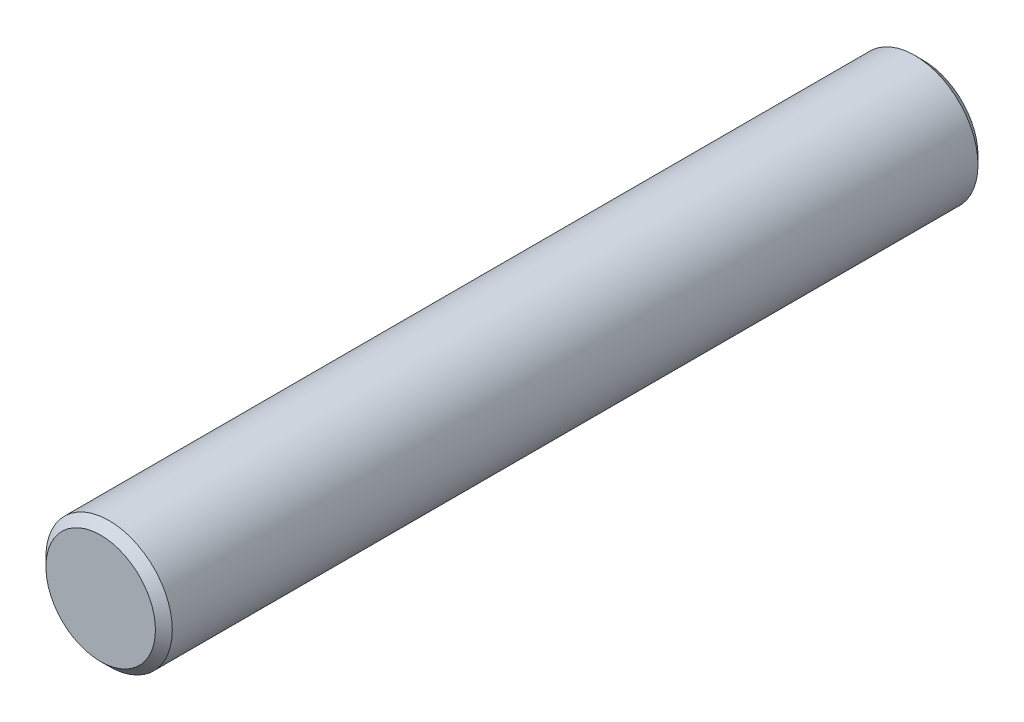
from build123d import *

# Parameters (mm, degrees)
SKETCH1_R      = 3.81
EXTRUDE1_DEPTH = 49.58806723
CHAMFER1_SIZE  = 0.508


with BuildPart() as part:
    # Sketch1 → Extrude1 (new body)
    with BuildSketch(Plane.XY):
        with Locations((0, 114.260861664)):
            Circle(SKETCH1_R)
    extrude(amount=-EXTRUDE1_DEPTH)

    # Chamfer1
    chamfer1_edges = [part.edges().sort_by_distance(p)[0] for p in [
        (-3.81, 114.260861664, 0),
        (-3.81, 114.260861664, -49.58806723),
    ]]
    chamfer(chamfer1_edges, length=CHAMFER1_SIZE)


solid = part.part
